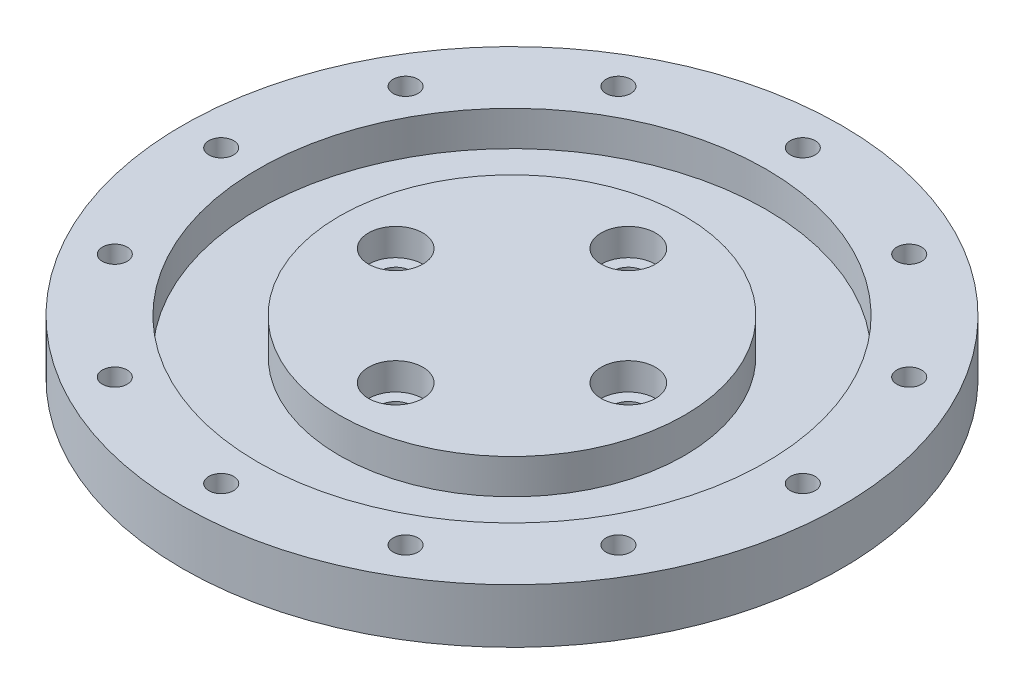
from build123d import *

# Parameters (mm, degrees)
SKETCH1_R           = 42.5
BOSS_EXTRUDE1_DEPTH = 7
SKETCH2_R           = 32.75
SKETCH2_R_2         = 22.25
CUT_EXTRUDE1_DEPTH  = 4.5
SKETCH3_R           = 1.6
CUT_EXTRUDE2_DEPTH  = 61.510329697
SKETCH4_R           = 2
CUT_EXTRUDE3_DEPTH  = 61.510329697
SKETCH5_R           = 3.5
SKETCH5_R_2         = 2
CUT_EXTRUDE4_DEPTH  = 3.5


with BuildPart() as part:
    # Sketch1 → Boss-Extrude1 (new body)
    with BuildSketch(Plane(origin=(0, 0, 0), x_dir=(1, 0, 0), z_dir=(0, 1, 0))):
        with Locations(Location((0, 0, 0), (0, 0, 270))):
            Circle(SKETCH1_R)
    extrude(amount=BOSS_EXTRUDE1_DEPTH)

    # Sketch2 → Cut-Extrude1 (cut)
    with BuildSketch(Plane(origin=(0, 7, 0), x_dir=(1, 0, 0), z_dir=(0, 1, 0))):
        with Locations(Location((0, 0, 0), (0, 0, 270))):
            Circle(SKETCH2_R)
        with Locations(Location((0, 0, 0), (0, 0, 270))):
            Circle(SKETCH2_R_2, mode=Mode.SUBTRACT)
    extrude(amount=-CUT_EXTRUDE1_DEPTH, mode=Mode.SUBTRACT)

    # Sketch3 → Cut-Extrude2 (cut, through all)
    with BuildSketch(Plane(origin=(0, 7, 0), x_dir=(1, 0, 0), z_dir=(0, 1, 0))):
        with Locations(Location((0, 37.5, 0), (0, 0, 270))):
            Circle(SKETCH3_R)
        with Locations(Location((18.75, 32.475952642, 0), (0, 0, 270))):
            Circle(SKETCH3_R)
        with Locations(Location((32.475952642, 18.75, 0), (0, 0, 270))):
            Circle(SKETCH3_R)
        with Locations(Location((37.5, 0, 0), (0, 0, 270))):
            Circle(SKETCH3_R)
        with Locations(Location((32.475952642, -18.75, 0), (0, 0, 270))):
            Circle(SKETCH3_R)
        with Locations(Location((18.75, -32.475952642, 0), (0, 0, 270))):
            Circle(SKETCH3_R)
        with Locations(Location((0, -37.5, 0), (0, 0, 270))):
            Circle(SKETCH3_R)
        with Locations(Location((-18.75, -32.475952642, 0), (0, 0, 270))):
            Circle(SKETCH3_R)
        with Locations(Location((-32.475952642, -18.75, 0), (0, 0, 270))):
            Circle(SKETCH3_R)
        with Locations(Location((-37.5, 0, 0), (0, 0, 270))):
            Circle(SKETCH3_R)
        with Locations(Location((-32.475952642, 18.75, 0), (0, 0, 270))):
            Circle(SKETCH3_R)
        with Locations(Location((-18.75, 32.475952642, 0), (0, 0, 270))):
            Circle(SKETCH3_R)
    extrude(amount=-CUT_EXTRUDE2_DEPTH, mode=Mode.SUBTRACT)

    # Sketch4 → Cut-Extrude3 (cut, through all)
    with BuildSketch(Plane(origin=(0, 7, 0), x_dir=(1, 0, 0), z_dir=(0, 1, 0))):
        with Locations(Location((0, 15, 0), (0, 0, 270))):
            Circle(SKETCH4_R)
        with Locations(Location((15, 0, 0), (0, 0, 270))):
            Circle(SKETCH4_R)
        with Locations(Location((0, -15, 0), (0, 0, 270))):
            Circle(SKETCH4_R)
        with Locations(Location((-15, 0, 0), (0, 0, 270))):
            Circle(SKETCH4_R)
    extrude(amount=-CUT_EXTRUDE3_DEPTH, mode=Mode.SUBTRACT)

    # Sketch5 → Cut-Extrude4 (cut)
    # profile 1 of 4: a face of its own
    with BuildSketch(Plane(origin=(0, 7, 0), x_dir=(1, 0, 0), z_dir=(0, 1, 0))):
        with Locations(Location((0, 15, 0), (0, 0, 270))):
            Circle(SKETCH5_R)
        with Locations(Location((0, 15, 0), (0, 0, 270))):
            Circle(SKETCH5_R_2, mode=Mode.SUBTRACT)
    # profile 2 of 4: a face of its own
    with BuildSketch(Plane(origin=(0, 7, 0), x_dir=(1, 0, 0), z_dir=(0, 1, 0))):
        with Locations(Location((15, 0, 0), (0, 0, 270))):
            Circle(SKETCH5_R)
    # profile 3 of 4: a face of its own
    with BuildSketch(Plane(origin=(0, 7, 0), x_dir=(1, 0, 0), z_dir=(0, 1, 0))):
        with Locations(Location((0, -15, 0), (0, 0, 270))):
            Circle(SKETCH5_R)
    # profile 4 of 4: a face of its own
    with BuildSketch(Plane(origin=(0, 7, 0), x_dir=(1, 0, 0), z_dir=(0, 1, 0))):
        with Locations(Location((-15, 0, 0), (0, 0, 270))):
            Circle(SKETCH5_R)
    extrude(amount=-CUT_EXTRUDE4_DEPTH, mode=Mode.SUBTRACT)


solid = part.part
